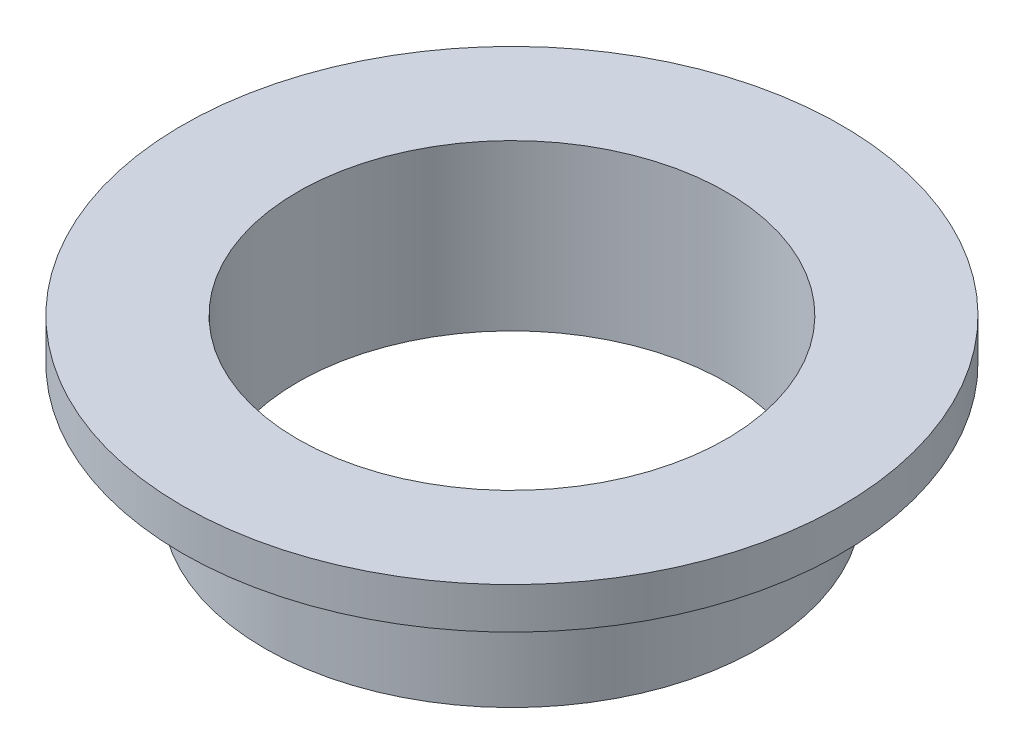
from build123d import *

# Parameters (mm, degrees)
SKETCH1_R           = 3
SKETCH1_R_2         = 2.6
BOSS_EXTRUDE1_DEPTH = 1.5
SKETCH2_R           = 4
SKETCH2_R_2         = 2.6
BOSS_EXTRUDE2_DEPTH = 0.5


with BuildPart() as part:
    # Sketch1 → Boss-Extrude1 (new body)
    with BuildSketch(Plane(origin=(0, 0, 0), x_dir=(1, 0, 0), z_dir=(0, 1, 0))):
        with Locations(Location((0, 0, 0), (0, 0, 270))):
            Circle(SKETCH1_R)
        with Locations(Location((0, 0, 0), (0, 0, 270))):
            Circle(SKETCH1_R_2, mode=Mode.SUBTRACT)
    extrude(amount=BOSS_EXTRUDE1_DEPTH)

    # Sketch2 → Boss-Extrude2 (add)
    with BuildSketch(Plane(origin=(0, 1.5, 0), x_dir=(1, 0, 0), z_dir=(0, 1, 0))):
        with Locations(Location((0, 0, 0), (0, 0, 270))):
            Circle(SKETCH2_R)
        with Locations(Location((0, 0, 0), (0, 0, 270))):
            Circle(SKETCH2_R_2, mode=Mode.SUBTRACT)
    extrude(amount=BOSS_EXTRUDE2_DEPTH)


solid = part.part
